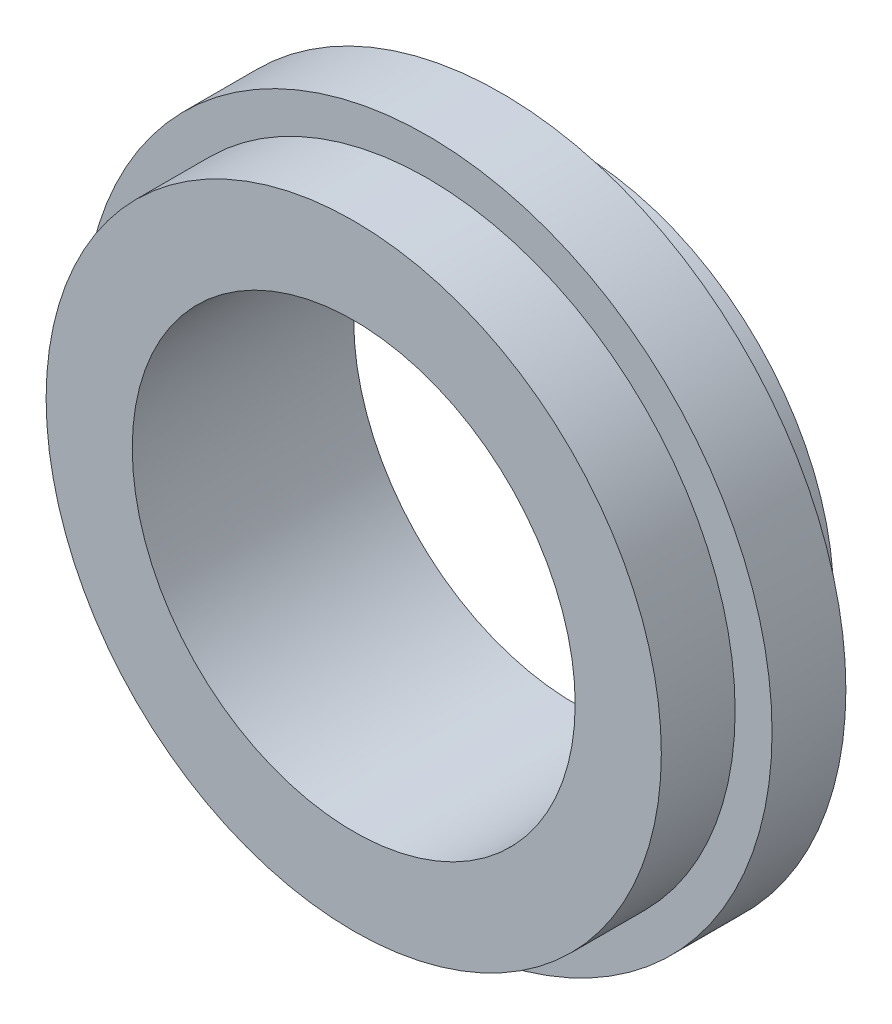
from build123d import *

# Parameters (mm, degrees)
SKETCH_1_R      = 10.5
SKETCH_1_R_2    = 9
EXTRUDE_1_DEPTH = 3
SKETCH_2_R      = 14
SKETCH_2_R_2    = 9
EXTRUDE_2_DEPTH = 3
SKETCH_3_R      = 12.5
SKETCH_3_R_2    = 9
EXTRUDE_3_DEPTH = 3


with BuildPart() as part:
    # 草图1 → 凸台-拉伸1 (new body)
    with BuildSketch(Plane.XY):
        Circle(SKETCH_1_R)
        Circle(SKETCH_1_R_2, mode=Mode.SUBTRACT)
    extrude(amount=EXTRUDE_1_DEPTH)

    # 草图2 → 凸台-拉伸2 (add)
    with BuildSketch(Plane.XY.offset(3)):
        Circle(SKETCH_2_R)
        Circle(SKETCH_2_R_2, mode=Mode.SUBTRACT)
    extrude(amount=EXTRUDE_2_DEPTH)

    # 草图3 → 凸台-拉伸3 (add)
    with BuildSketch(Plane.XY.offset(6)):
        Circle(SKETCH_3_R)
        Circle(SKETCH_3_R_2, mode=Mode.SUBTRACT)
    extrude(amount=EXTRUDE_3_DEPTH)


solid = part.part
